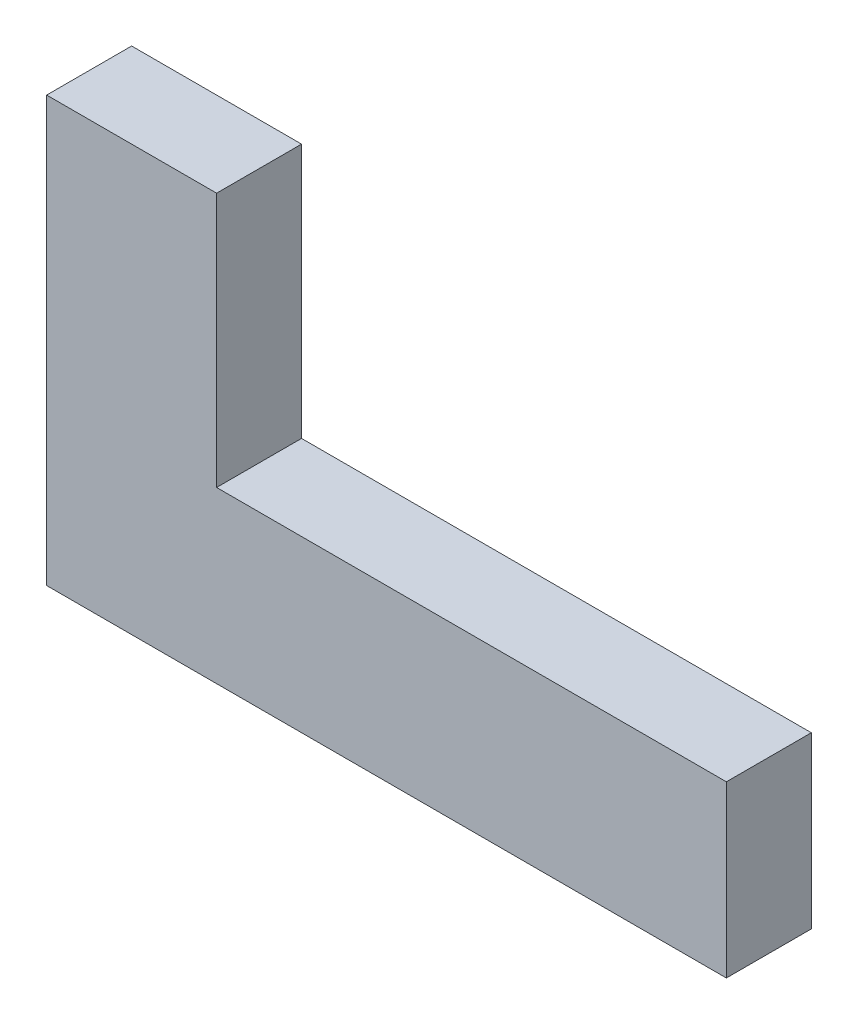
from build123d import *

# Parameters (mm, degrees)
BOSS_EXTRUDE1_DEPTH = 10


with BuildPart() as part:
    # Sketch1 → Boss-Extrude1 (new body)
    with BuildSketch(Plane.XY):
        Polygon((-53.070866142, 38.877952756), (-53.070866142, -11.122047244), (26.929133858, -11.122047244), (26.929133858, 8.877952756), (-33.070866142, 8.877952756), (-33.070866142, 38.877952756), align=None)
    extrude(amount=BOSS_EXTRUDE1_DEPTH)


solid = part.part
